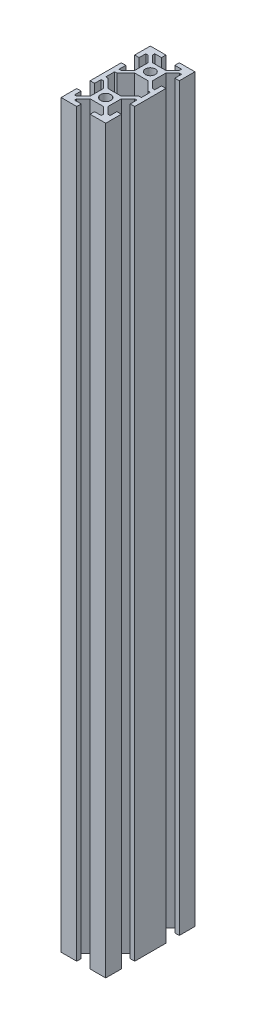
from build123d import *

# Parameters (mm, degrees)
SKETCH1_R           = 2.213186583
SKETCH1_R_2         = 2.28890728
BOSS_EXTRUDE1_DEPTH = 332


with BuildPart() as part:
    # Sketch1 → Boss-Extrude1 (new body)
    with BuildSketch(Plane(origin=(0, 0, 0), x_dir=(1, 0, 0), z_dir=(0, 1, 0))):
        Polygon((20, 0), (20, -7), (18, -7), (18, -4), (17, -4), (14, -7), (14, -13), (17, -16), (18, -16), (18, -13), (20, -13), (20, -27), (18, -27), (18, -24), (17, -24), (14, -27), (14, -33), (17, -36), (18, -36), (18, -33), (20, -33), (20, -40), (13, -40), (13, -38), (16, -38), (16, -37), (13, -34), (7, -34), (4, -37), (4, -38), (7, -38), (7, -40), (0, -40), (0, -33), (2, -33), (2, -36), (3, -36), (6, -33), (6, -27), (3, -24), (2, -24), (2, -27), (0, -27), (0, -13), (2, -13), (2, -16), (3, -16), (6, -13), (6, -7), (3, -4), (2, -4), (2, -7), (0, -7), (0, 0), (7, 0), (7, -2), (4, -2), (4, -3), (7, -6), (13, -6), (16, -3), (16, -2), (13, -2), (13, 0), align=None)
        with Locations(Location((10, -10, 0), (0, 0, 270))):
            Circle(SKETCH1_R, mode=Mode.SUBTRACT)
        with Locations(Location((10, -30, 0), (0, 0, 270))):
            Circle(SKETCH1_R_2, mode=Mode.SUBTRACT)
        Polygon((7, -14), (13, -14), (17, -18), (18, -18), (18, -22), (17, -22), (13, -26), (7, -26), (3, -22), (2, -22), (2, -18), (3, -18), align=None, mode=Mode.SUBTRACT)
    extrude(amount=BOSS_EXTRUDE1_DEPTH)


solid = part.part
